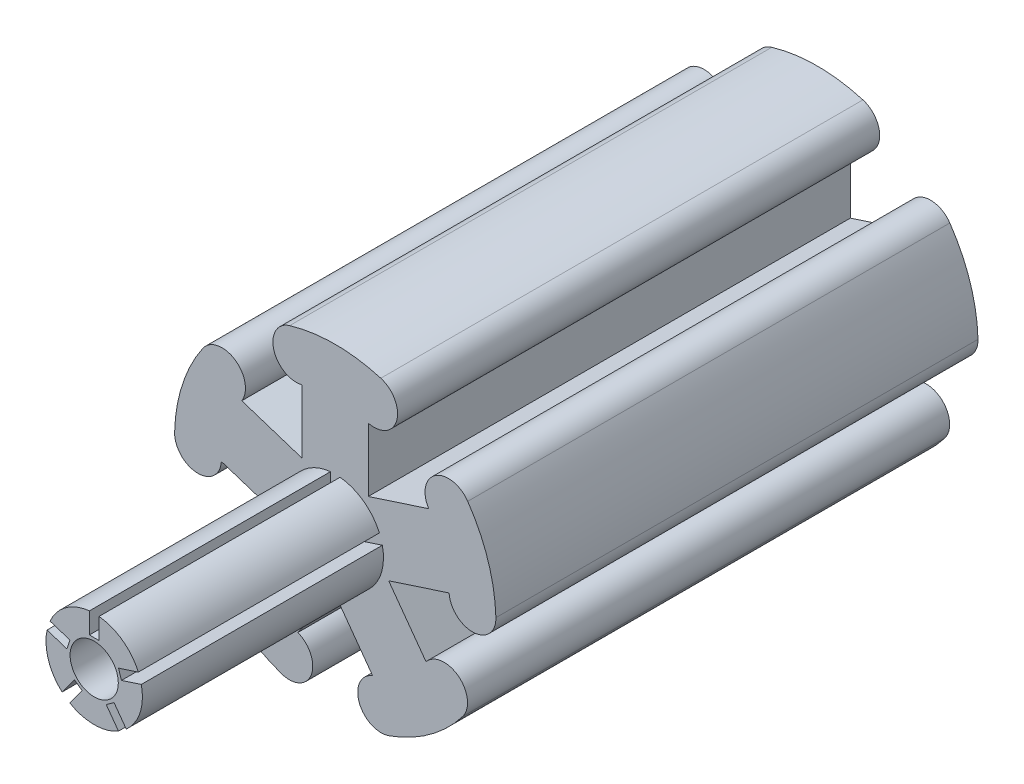
from build123d import *

# Parameters (mm, degrees)
BOSS_EXTRUDE3_DEPTH = 30
CIRPATTERN1_COUNT   = 5
BOSS_EXTRUDE4_DEPTH = 15
SKETCH6_R           = 1.5
CUT_EXTRUDE1_DEPTH  = 80


with BuildPart() as part:
    # Sketch2 → Boss-Extrude3 (new body)
    with BuildSketch(Plane.XY):
        with BuildLine():
            Line((-2.054029869, 6.78303703), (-2.054029869, 0))
            Line((-2.054029869, 0), (2.054029869, 0))
            Line((2.054029869, 0), (2.054029869, 6.78303703))
            ThreePointArc((2.054029869, 6.78303703), (3.825708627, 7.801903653), (2.835284544, 9.589638239))
            ThreePointArc((2.835284544, 9.589638239), (0, 10), (-2.835284544, 9.589638239))
            ThreePointArc((-2.835284544, 9.589638239), (-3.825708627, 7.801903653), (-2.054029869, 6.78303703))
        make_face()
    extrude(amount=-BOSS_EXTRUDE3_DEPTH)

    # CirPattern1: part ×5 about axis
    cirpattern1_axis = Axis((0, 0, 0), (0, 0, 1))


with BuildPart() as part_1:
    add(part.part)
    for i in range(1, CIRPATTERN1_COUNT):
        add(part.part.rotate(cirpattern1_axis, i * 360 / CIRPATTERN1_COUNT))

    # Sketch7 → Boss-Extrude4 (add)
    with BuildSketch(Plane.XY):
        with BuildLine():
            Line((0.3, 2.984962311), (0.3, 1.687380928))
            Line((0.3, 1.687380928), (-0.3, 1.687380928))
            Line((-0.3, 1.687380928), (-0.3, 2.984962311))
            ThreePointArc((-0.3, 2.984962311), (-1.763355757, 2.427050983), (-2.746162759, 1.207721037))
            Line((-2.746162759, 1.207721037), (-1.512089528, 0.806746337))
            Line((-1.512089528, 0.806746337), (-1.697499725, 0.236112428))
            Line((-1.697499725, 0.236112428), (-2.931572955, 0.637087127))
            ThreePointArc((-2.931572955, 0.637087127), (-2.853169549, -0.927050983), (-1.997221924, -2.238549662))
            Line((-1.997221924, -2.238549662), (-1.234522723, -1.188784271))
            Line((-1.234522723, -1.188784271), (-0.749112526, -1.541455422))
            Line((-0.749112526, -1.541455422), (-1.511811727, -2.591220813))
            ThreePointArc((-1.511811727, -2.591220813), (0, -3), (1.511811727, -2.591220813))
            Line((1.511811727, -2.591220813), (0.749112526, -1.541455422))
            Line((0.749112526, -1.541455422), (1.234522723, -1.188784271))
            Line((1.234522723, -1.188784271), (1.997221924, -2.238549662))
            ThreePointArc((1.997221924, -2.238549662), (2.737851874, -1.226444909), (3, 0))
            ThreePointArc((3, 0), (2.982844185, 0.320375665), (2.931572955, 0.637087127))
            Line((2.931572955, 0.637087127), (1.697499725, 0.236112428))
            Line((1.697499725, 0.236112428), (1.512089528, 0.806746337))
            Line((1.512089528, 0.806746337), (2.746162759, 1.207721037))
            ThreePointArc((2.746162759, 1.207721037), (1.763355757, 2.427050983), (0.3, 2.984962311))
        make_face()
    extrude(amount=BOSS_EXTRUDE4_DEPTH)

    # Sketch6 → Cut-Extrude1 (cut)
    with BuildSketch(Plane(origin=(0, 0, -30), x_dir=(-1, 0, 0), z_dir=(0, 0, -1))):
        Circle(SKETCH6_R)
    extrude(amount=-CUT_EXTRUDE1_DEPTH, mode=Mode.SUBTRACT)


solid = part_1.part
